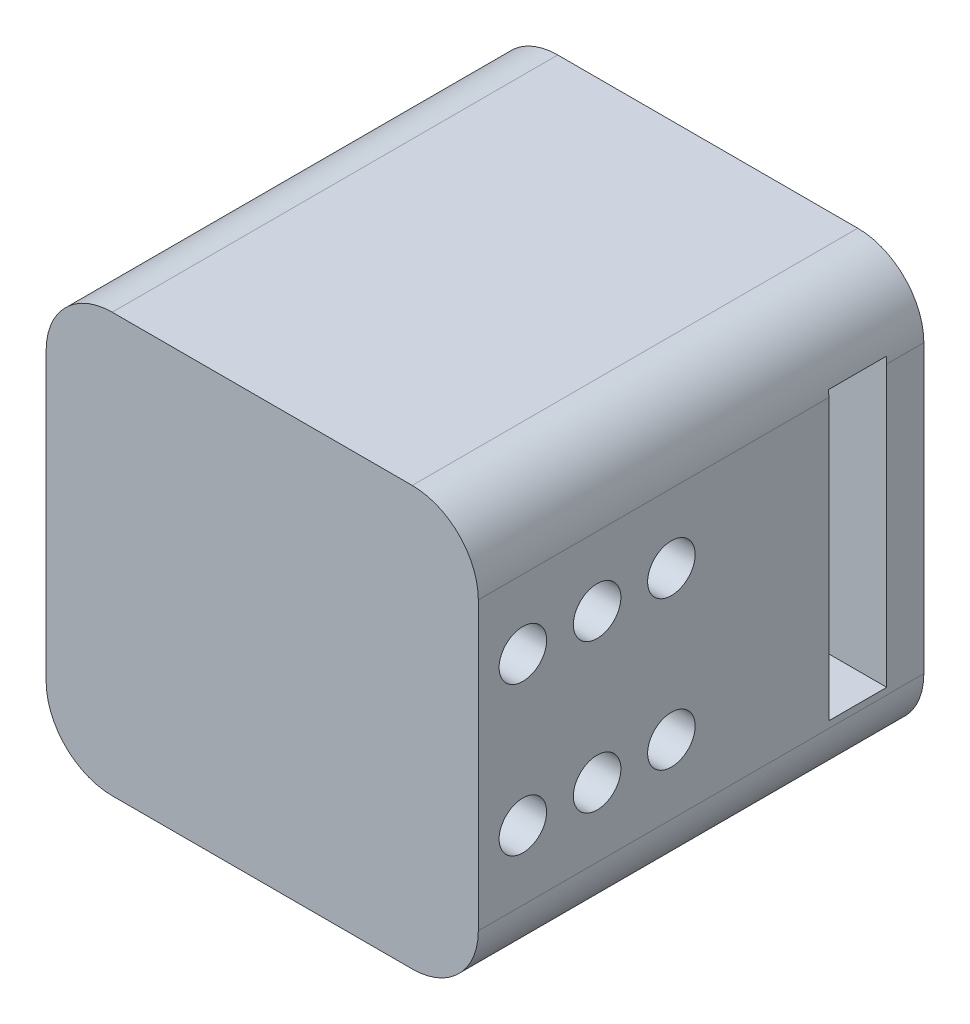
from build123d import *

# Parameters (mm, degrees)
EXTRUDE_1_DEPTH     = 30
SKETCH_2_R          = 1.6
CUT_EXTRUDE_1_DEPTH = 3.2
SKETCH_4_W          = 3.9
SKETCH_4_H          = 19.3
CUT_EXTRUDE_2_DEPTH = 23
SKETCH_5_W          = 3.9
SKETCH_5_H          = 19.3
CUT_EXTRUDE_3_DEPTH = 23
SKETCH_6_W          = 6.9
SKETCH_6_H          = 4.9
CUT_EXTRUDE_4_DEPTH = 20


with BuildPart() as part:
    # 草图1 → 凸台-拉伸1 (new body)
    with BuildSketch(Plane.XY):
        with BuildLine():
            Line((-10.1, 14.1), (10.1, 14.1))
            ThreePointArc((10.1, 14.1), (13.246625176, 12.796625176), (14.55, 9.65))
            Line((14.55, 9.65), (14.55, -9.65))
            ThreePointArc((14.55, -9.65), (13.246625176, -12.796625176), (10.1, -14.1))
            Line((10.1, -14.1), (-10.1, -14.1))
            ThreePointArc((-10.1, -14.1), (-13.246625176, -12.796625176), (-14.55, -9.65))
            Line((-14.55, -9.65), (-14.55, 9.65))
            ThreePointArc((-14.55, 9.65), (-13.246625176, 12.796625176), (-10.1, 14.1))
        make_face()
    extrude(amount=EXTRUDE_1_DEPTH)

    # 草图2 → 切除-拉伸1 (cut)
    with BuildSketch(Plane(origin=(14.55, 0, 0), x_dir=(0, 0, -1), z_dir=(1, 0, 0))):
        with Locations(Location((-27, -5, 0), (0, 0, 90))):
            Circle(SKETCH_2_R)
        with Locations(Location((-22, -5, 0), (0, 0, 90))):
            Circle(SKETCH_2_R)
        with Locations(Location((-17, -5, 0), (0, 0, 90))):
            Circle(SKETCH_2_R)
        with Locations(Location((-22, 5, 0), (0, 0, 90))):
            Circle(SKETCH_2_R)
        with Locations(Location((-17, 5, 0), (0, 0, 90))):
            Circle(SKETCH_2_R)
        with Locations(Location((-27, 5, 0), (0, 0, 90))):
            Circle(SKETCH_2_R)
    cut_extrude_1 = extrude(amount=-CUT_EXTRUDE_1_DEPTH, mode=Mode.SUBTRACT)

    # 镜向1: 切除-拉伸1 across plane
    add(cut_extrude_1.mirror(Plane(origin=(0, 0, 0), x_dir=(0, 0, 1), z_dir=(1, 0, 0))), mode=Mode.SUBTRACT)

    # 草图4 → 切除-拉伸2 (cut)
    with BuildSketch(Plane(origin=(14.55, 0, 0), x_dir=(0, 0, -1), z_dir=(1, 0, 0))):
        with Locations((-4.45, 0.45)):
            Rectangle(SKETCH_4_W, SKETCH_4_H)
    extrude(amount=-CUT_EXTRUDE_2_DEPTH, mode=Mode.SUBTRACT)

    # 草图5 → 切除-拉伸3 (cut)
    with BuildSketch(Plane.ZY.offset(14.55)):
        with Locations((10.35, 0.45)):
            Rectangle(SKETCH_5_W, SKETCH_5_H)
    extrude(amount=-CUT_EXTRUDE_3_DEPTH, mode=Mode.SUBTRACT)

    # 草图6 → 切除-拉伸4 (cut)
    with BuildSketch(Plane(origin=(0, 0, 0), x_dir=(-1, 0, 0), z_dir=(0, 0, -1))):
        with Locations((0, -11.65)):
            Rectangle(SKETCH_6_W, SKETCH_6_H)
    extrude(amount=-CUT_EXTRUDE_4_DEPTH, mode=Mode.SUBTRACT)


solid = part.part
